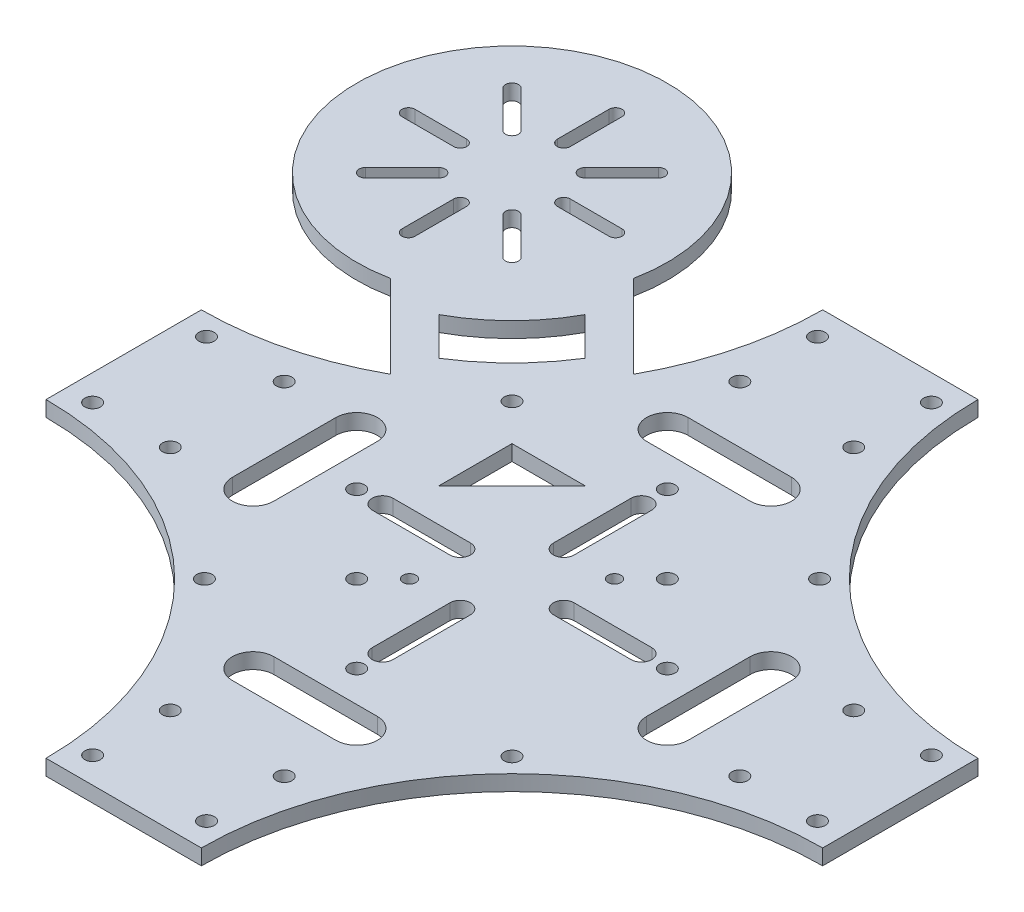
from build123d import *

# Parameters (mm, degrees)
SKETCH_1_R               = 1.25
EXTRUDE_1_DEPTH          = 3
SKETCH_2_R               = 1.5
CUT_EXTRUDE_1_DEPTH      = 3
CUT_EXTRUDE_2_DEPTH      = 3
CUT_EXTRUDE_3_DEPTH      = 3
CUT_EXTRUDE_4_DEPTH      = 10
SKETCH_6_R               = 1.5
CUT_EXTRUDE_5_DEPTH      = 10
SKETCH_7_R               = 1.5
CUT_EXTRUDE_8_DEPTH      = 10
SKETCH_8_R               = 1.5
CUT_EXTRUDE_9_DEPTH      = 10
SKETCH_9_R               = 15
CUT_EXTRUDE_10_DEPTH     = 10
SKETCH_11_R              = 1.5
EXTRUDE_3_DEPTH          = 3
CUT_EXTRUDE_12_DEPTH     = 3
EXTRUDE_4_DEPTH          = 3
SKETCH_15_R              = 15
EXTRUDE_5_DEPTH          = 3
CUT_EXTRUDE_13_DEPTH     = 3
EXTRUDE_START            = -3
EXTRUDE_7_DEPTH          = 3
CUT_EXTRUDE_14_DEPTH     = 3
CUT_EXTRUDE_15_DEPTH     = 3
PATTERN_CIRCULAR_1_COUNT = 8
SKETCH_22_R              = 1.25
CUT_EXTRUDE_17_DEPTH     = 3
SKETCH_23_R              = 1.5
CUT_EXTRUDE_18_DEPTH     = 10
SKETCH_24_R              = 1.5
CUT_EXTRUDE_19_DEPTH     = 10
CUT_EXTRUDE_20_DEPTH     = 10
SKETCH_26_R              = 1.5
CUT_EXTRUDE_21_DEPTH     = 66


with BuildPart() as part:
    # 草图1 → 凸台-拉伸1 (new body)
    # profile 1 of 4: a face of its own
    with BuildSketch(Plane(origin=(0, 0, 0), x_dir=(1, 0, 0), z_dir=(0, 1, 0))):
        with BuildLine():
            ThreePointArc((75, -15), (32.573593129, -32.573593129), (15, -75))
            Line((15, -75), (0, -75))
            Line((0, -75), (0, 0))
            Line((0, 0), (75, 0))
            Line((75, 0), (75, -15))
        make_face()
        with Locations(Location((11, -70, 0), (0, 0, 270))):
            Circle(SKETCH_1_R, mode=Mode.SUBTRACT)
        with Locations(Location((70, -11, 0), (0, 0, 270))):
            Circle(SKETCH_1_R, mode=Mode.SUBTRACT)
    # profile 2 of 4: a face of its own
    with BuildSketch(Plane(origin=(0, 0, 0), x_dir=(1, 0, 0), z_dir=(0, 1, 0))):
        with BuildLine():
            ThreePointArc((-15, -75), (-32.573593129, -32.573593129), (-75, -15))
            Line((-75, -15), (-75, 0))
            Line((-75, 0), (0, 0))
            Line((0, 0), (0, -75))
            Line((0, -75), (-15, -75))
        make_face()
        with Locations(Location((-70, -11, 0), (0, 0, 270))):
            Circle(SKETCH_1_R, mode=Mode.SUBTRACT)
        with Locations(Location((-11, -70, 0), (0, 0, 270))):
            Circle(SKETCH_1_R, mode=Mode.SUBTRACT)
    # profile 3 of 4: a face of its own
    with BuildSketch(Plane(origin=(0, 0, 0), x_dir=(1, 0, 0), z_dir=(0, 1, 0))):
        with BuildLine():
            ThreePointArc((-75, 15), (-32.573593129, 32.573593129), (-15, 75))
            Line((-15, 75), (0, 75))
            Line((0, 75), (0, 0))
            Line((0, 0), (-75, 0))
            Line((-75, 0), (-75, 15))
        make_face()
        with Locations(Location((-11, 70, 0), (0, 0, 270))):
            Circle(SKETCH_1_R, mode=Mode.SUBTRACT)
        with Locations(Location((-70, 11, 0), (0, 0, 270))):
            Circle(SKETCH_1_R, mode=Mode.SUBTRACT)
    # profile 4 of 4: a face of its own
    with BuildSketch(Plane(origin=(0, 0, 0), x_dir=(1, 0, 0), z_dir=(0, 1, 0))):
        with BuildLine():
            ThreePointArc((15, 75), (32.573593129, 32.573593129), (75, 15))
            Line((75, 15), (75, 0))
            Line((75, 0), (0, 0))
            Line((0, 0), (0, 75))
            Line((0, 75), (15, 75))
        make_face()
        with Locations(Location((70, 11, 0), (0, 0, 270))):
            Circle(SKETCH_1_R, mode=Mode.SUBTRACT)
        with Locations(Location((11, 70, 0), (0, 0, 270))):
            Circle(SKETCH_1_R, mode=Mode.SUBTRACT)
    extrude(amount=EXTRUDE_1_DEPTH)

    # 草图2 → 切除-拉伸1 (cut)
    with BuildSketch(Plane.XZ):
        with Locations(Location((0.353553391, -31.466251763, 0), (0, 0, 270))):
            Circle(SKETCH_2_R)
        with Locations(Location((31.466251763, -0.353553391, 0), (0, 0, 270))):
            Circle(SKETCH_2_R)
        with Locations(Location((-0.353553391, 31.466251763, 0), (0, 0, 90))):
            Circle(SKETCH_2_R)
        with Locations(Location((-31.466251763, 0.353553391, 0), (0, 0, 90))):
            Circle(SKETCH_2_R)
    extrude(amount=-CUT_EXTRUDE_1_DEPTH, mode=Mode.SUBTRACT)

    # 草图3 → 切除-拉伸2 (cut)
    with BuildSketch(Plane(origin=(0, 3, 0), x_dir=(1, 0, 0), z_dir=(0, 1, 0))):
        Polygon((-15.556349186, 15.556349186), (-12.02081528, 19.091883092), (-22.627416998, 22.627416998), align=None)
        Polygon((-19.091883092, 12.02081528), (-15.556349186, 15.556349186), (-22.627416998, 22.627416998), align=None)
    extrude(amount=-CUT_EXTRUDE_2_DEPTH, mode=Mode.SUBTRACT)

    # 草图4 → 切除-拉伸3 (cut)
    with BuildSketch(Plane(origin=(0, 3, 0), x_dir=(1, 0, 0), z_dir=(0, 1, 0))):
        with BuildLine():
            ThreePointArc((33.944668714, -19.80253309), (34.043922781, -8.582763971), (22.827665534, -8.285032838))
            Line((22.827665534, -8.285032838), (15.556349186, -15.556349186))
            Line((15.556349186, -15.556349186), (8.285032838, -22.827665534))
            ThreePointArc((8.285032838, -22.827665534), (8.582763971, -34.043922781), (19.80253309, -33.944668714))
            Line((19.80253309, -33.944668714), (33.944668714, -19.80253309))
        make_face()
    extrude(amount=-CUT_EXTRUDE_3_DEPTH, mode=Mode.SUBTRACT)

    # 草图5 → 切除-拉伸4 (cut)
    with BuildSketch(Plane(origin=(0, 3, 0), x_dir=(1, 0, 0), z_dir=(0, 1, 0))):
        Polygon((-22.627416998, 8.485281374), (-22.627416998, 22.627416998), (-19.091883092, 12.02081528), align=None)
        Polygon((-12.02081528, 19.091883092), (-22.627416998, 22.627416998), (-8.485281374, 22.627416998), align=None)
    extrude(amount=-CUT_EXTRUDE_4_DEPTH, mode=Mode.SUBTRACT)

    # 草图6 → 切除-拉伸5 (cut)
    with BuildSketch(Plane(origin=(0, 3, 0), x_dir=(1, 0, 0), z_dir=(0, 1, 0))):
        with Locations(Location((-35.355339059, -21.213203436, 0), (0, 0, 270))):
            Circle(SKETCH_6_R)
        with Locations(Location((-21.213203436, -35.355339059, 0), (0, 0, 270))):
            Circle(SKETCH_6_R)
        with Locations(Location((35.355339059, 21.213203436, 0), (0, 0, 270))):
            Circle(SKETCH_6_R)
        with Locations(Location((21.213203436, 35.355339059, 0), (0, 0, 270))):
            Circle(SKETCH_6_R)
    extrude(amount=-CUT_EXTRUDE_5_DEPTH, mode=Mode.SUBTRACT)

    # 草图7 → 切除-拉伸8 (cut)
    with BuildSketch(Plane(origin=(0, 3, 0), x_dir=(1, 0, 0), z_dir=(0, 1, 0))):
        with Locations(Location((-29.69848481, 29.69848481, 0), (0, 0, 270))):
            Circle(SKETCH_7_R)
        with Locations(Location((29.69848481, 29.69848481, 0), (0, 0, 270))):
            Circle(SKETCH_7_R)
        with Locations(Location((29.69848481, -29.69848481, 0), (0, 0, 270))):
            Circle(SKETCH_7_R)
        with Locations(Location((-29.69848481, -29.69848481, 0), (0, 0, 270))):
            Circle(SKETCH_7_R)
    extrude(amount=-CUT_EXTRUDE_8_DEPTH, mode=Mode.SUBTRACT)

    # 草图8 → 切除-拉伸9 (cut)
    with BuildSketch(Plane(origin=(0, 3, 0), x_dir=(1, 0, 0), z_dir=(0, 1, 0))):
        with Locations(Location((-11, 55, 0), (0, 0, 270))):
            Circle(SKETCH_8_R)
        with Locations(Location((11, 55, 0), (0, 0, 270))):
            Circle(SKETCH_8_R)
        with Locations(Location((55, 11, 0), (0, 0, 270))):
            Circle(SKETCH_8_R)
        with Locations(Location((55, -11, 0), (0, 0, 270))):
            Circle(SKETCH_8_R)
        with Locations(Location((11, -55, 0), (0, 0, 270))):
            Circle(SKETCH_8_R)
        with Locations(Location((-11, -55, 0), (0, 0, 270))):
            Circle(SKETCH_8_R)
        with Locations(Location((-55, -11, 0), (0, 0, 270))):
            Circle(SKETCH_8_R)
        with Locations(Location((-55, 11, 0), (0, 0, 270))):
            Circle(SKETCH_8_R)
    extrude(amount=-CUT_EXTRUDE_9_DEPTH, mode=Mode.SUBTRACT)

    # 草图9 → 切除-拉伸10 (cut)
    with BuildSketch(Plane(origin=(0, 3, 0), x_dir=(1, 0, 0), z_dir=(0, 1, 0))):
        with Locations(Location((0, 0, 0), (0, 0, 270))):
            Circle(SKETCH_9_R)
    extrude(amount=-CUT_EXTRUDE_10_DEPTH, mode=Mode.SUBTRACT)

    # 草图11 → 凸台-拉伸3 (add)
    with BuildSketch(Plane(origin=(0, 3, 0), x_dir=(1, 0, 0), z_dir=(0, 1, 0))):
        with Locations((-35.355339059, -21.213203436)):
            Circle(SKETCH_11_R)
        with Locations((35.355339059, 21.213203436)):
            Circle(SKETCH_11_R)
        with Locations((21.213203436, 35.355339059)):
            Circle(SKETCH_11_R)
        with Locations((0.353553391, 31.466251763)):
            Circle(SKETCH_11_R)
        with Locations((31.466251763, 0.353553391)):
            Circle(SKETCH_11_R)
        with Locations((-0.353553391, -31.466251763)):
            Circle(SKETCH_11_R)
        with Locations((-31.466251763, -0.353553391)):
            Circle(SKETCH_11_R)
        with Locations((-21.213203436, -35.355339059)):
            Circle(SKETCH_11_R)
    extrude(amount=-EXTRUDE_3_DEPTH)

    # 草图12 → 切除-拉伸12 (cut)
    with BuildSketch(Plane(origin=(0, 3, 0), x_dir=(1, 0, 0), z_dir=(0, 1, 0))):
        with BuildLine():
            Line((-44, -10), (-44, 10))
            ThreePointArc((-44, 10), (-40, 14), (-36, 10))
            Line((-36, 10), (-36, -10))
            ThreePointArc((-36, -10), (-40, -14), (-44, -10))
        make_face()
        with BuildLine():
            Line((-10, 44), (10, 44))
            ThreePointArc((10, 44), (14, 40), (10, 36))
            Line((10, 36), (-10, 36))
            ThreePointArc((-10, 36), (-14, 40), (-10, 44))
        make_face()
        with BuildLine():
            Line((44, 10), (44, -10))
            ThreePointArc((44, -10), (40, -14), (36, -10))
            Line((36, -10), (36, 10))
            ThreePointArc((36, 10), (40, 14), (44, 10))
        make_face()
        with BuildLine():
            Line((10, -44), (-10, -44))
            ThreePointArc((-10, -44), (-14, -40), (-10, -36))
            Line((-10, -36), (10, -36))
            ThreePointArc((10, -36), (14, -40), (10, -44))
        make_face()
    extrude(amount=-CUT_EXTRUDE_12_DEPTH, mode=Mode.SUBTRACT)

    # 草图14 → 凸台-拉伸4 (add)
    with BuildSketch(Plane(origin=(0, 3, 0), x_dir=(1, 0, 0), z_dir=(0, 1, 0))):
        with BuildLine():
            ThreePointArc((32.185650849, -7.152183109), (27.322232167, -6.195143755), (22.827665534, -8.285032838))
            Line((22.827665534, -8.285032838), (21.61516096, -18.569682002))
            ThreePointArc((21.61516096, -18.569682002), (27.487806659, -22.107425519), (33.944668714, -19.80253309))
            ThreePointArc((33.944668714, -19.80253309), (35.679936943, -17.205520658), (36.289282113, -14.142135624))
            ThreePointArc((36.289282113, -14.142135624), (35.187559777, -10.089382679), (32.185650849, -7.152183109))
        make_face()
        with BuildLine():
            Line((22.827665534, -8.285032838), (22.427168462, -8.685529911))
            ThreePointArc((22.427168462, -8.685529911), (20.306137435, -13.486712231), (21.61516096, -18.569682002))
            Line((21.61516096, -18.569682002), (22.827665534, -8.285032838))
        make_face()
        with BuildLine():
            Line((22.427168462, -8.685529911), (8.285032838, -22.827665534))
            ThreePointArc((8.285032838, -22.827665534), (8.582763971, -34.043922781), (19.80253309, -33.944668714))
            Line((19.80253309, -33.944668714), (21.61516096, -18.569682002))
            ThreePointArc((21.61516096, -18.569682002), (20.306137435, -13.486712231), (22.427168462, -8.685529911))
        make_face()
        with BuildLine():
            Line((21.61516096, -18.569682002), (19.80253309, -33.944668714))
            Line((19.80253309, -33.944668714), (33.944668714, -19.80253309))
            ThreePointArc((33.944668714, -19.80253309), (27.487806659, -22.107425519), (21.61516096, -18.569682002))
        make_face()
    extrude(amount=-EXTRUDE_4_DEPTH)

    # 草图15 → 凸台-拉伸5 (add)
    with BuildSketch(Plane(origin=(0, 3, 0), x_dir=(1, 0, 0), z_dir=(0, 1, 0))):
        Circle(SKETCH_15_R)
    extrude(amount=-EXTRUDE_5_DEPTH)

    # 草图17 → 切除-拉伸13 (cut)
    with BuildSketch(Plane(origin=(0, 3, 0), x_dir=(1, 0, 0), z_dir=(0, 1, 0))):
        with BuildLine():
            Line((-2, -20), (-2, -10))
            ThreePointArc((-2, -10), (0, -8), (2, -10))
            Line((2, -10), (2, -20))
            ThreePointArc((2, -20), (0, -22), (-2, -20))
        make_face()
        with BuildLine():
            Line((-20, 2), (-10, 2))
            ThreePointArc((-10, 2), (-8, 0), (-10, -2))
            Line((-10, -2), (-20, -2))
            ThreePointArc((-20, -2), (-22, 0), (-20, 2))
        make_face()
        with BuildLine():
            Line((2, 20), (2, 10))
            ThreePointArc((2, 10), (0, 8), (-2, 10))
            Line((-2, 10), (-2, 20))
            ThreePointArc((-2, 20), (0, 22), (2, 20))
        make_face()
        with BuildLine():
            Line((20, -2), (10, -2))
            ThreePointArc((10, -2), (8, 0), (10, 2))
            Line((10, 2), (20, 2))
            ThreePointArc((20, 2), (22, 0), (20, -2))
        make_face()
    extrude(amount=-CUT_EXTRUDE_13_DEPTH, mode=Mode.SUBTRACT)

    # 草图18 → 凸台-拉伸7 (add)
    with BuildSketch(Plane(origin=(0, 3, 0), x_dir=(1, 0, 0), z_dir=(0, 1, 0)).offset(EXTRUDE_START)):
        with BuildLine():
            Line((-61.977302058, 38.525223259), (-50.251262658, 50.251262658))
            Line((-50.251262658, 50.251262658), (-38.525223259, 61.977302058))
            ThreePointArc((-38.525223259, 61.977302058), (-38.078377186, 64.938218885), (-37.928932188, 67.928932188))
            ThreePointArc((-37.928932188, 67.928932188), (-91.15121571, 86.921708395), (-61.977302058, 38.525223259))
        make_face()
        with BuildLine():
            ThreePointArc((-61.977302058, 38.525223259), (-53.742560533, 41.49511182), (-46.715728753, 46.715728753))
            Line((-46.715728753, 46.715728753), (-50.251262658, 50.251262658))
            Line((-50.251262658, 50.251262658), (-61.977302058, 38.525223259))
        make_face()
        with BuildLine():
            Line((-50.251262658, 50.251262658), (-46.715728753, 46.715728753))
            ThreePointArc((-46.715728753, 46.715728753), (-41.49511182, 53.742560534), (-38.525223259, 61.977302058))
            Line((-38.525223259, 61.977302058), (-50.251262658, 50.251262658))
        make_face()
        with BuildLine():
            ThreePointArc((-45.952273324, 22.500194525), (-38.909748111, 27.067821679), (-32.573593129, 32.573593129))
            Line((-32.573593129, 32.573593129), (-46.715728753, 46.715728753))
            ThreePointArc((-46.715728753, 46.715728753), (-53.742560533, 41.49511182), (-61.977302058, 38.525223259))
            Line((-61.977302058, 38.525223259), (-45.952273324, 22.500194525))
        make_face()
        with BuildLine():
            Line((-46.715728753, 46.715728753), (-32.573593129, 32.573593129))
            ThreePointArc((-32.573593129, 32.573593129), (-27.067821679, 38.909748111), (-22.500194525, 45.952273324))
            Line((-22.500194525, 45.952273324), (-38.525223259, 61.977302058))
            ThreePointArc((-38.525223259, 61.977302058), (-41.49511182, 53.742560534), (-46.715728753, 46.715728753))
        make_face()
    extrude(amount=EXTRUDE_7_DEPTH)

    # 草图19 → 切除-拉伸14 (cut)
    with BuildSketch(Plane(origin=(0, 3, 0), x_dir=(1, 0, 0), z_dir=(0, 1, 0))):
        with BuildLine():
            ThreePointArc((-37.140781925, 51.282917549), (-39.866501787, 47.012431525), (-43.180194847, 43.180194847))
            Line((-43.180194847, 43.180194847), (-36.109127035, 36.109127035))
            ThreePointArc((-36.109127035, 36.109127035), (-32.750813989, 39.866501787), (-29.833680261, 43.975815885))
            Line((-29.833680261, 43.975815885), (-37.140781925, 51.282917549))
        make_face()
        with BuildLine():
            Line((-36.109127035, 36.109127035), (-43.180194847, 43.180194847))
            ThreePointArc((-43.180194847, 43.180194847), (-47.012431525, 39.866501787), (-51.282917549, 37.140781925))
            Line((-51.282917549, 37.140781925), (-43.975815885, 29.833680261))
            ThreePointArc((-43.975815885, 29.833680261), (-39.866501787, 32.750813989), (-36.109127035, 36.109127035))
        make_face()
    extrude(amount=-CUT_EXTRUDE_14_DEPTH, mode=Mode.SUBTRACT)

    # 草图21 → 切除-拉伸15 (cut)
    with BuildSketch(Plane(origin=(0, 3, 0), x_dir=(1, 0, 0), z_dir=(0, 1, 0))):
        with BuildLine():
            Line((-81.187184335, 82.954951288), (-74.116116524, 75.883883476))
            ThreePointArc((-74.116116524, 75.883883476), (-74.116116524, 74.116116524), (-75.883883476, 74.116116524))
            Line((-75.883883476, 74.116116524), (-82.954951288, 81.187184335))
            ThreePointArc((-82.954951288, 81.187184335), (-82.954951288, 82.954951288), (-81.187184335, 82.954951288))
        make_face()
        with BuildLine():
            Line((-59.9739809, 61.741747853), (-52.902913088, 54.670680041))
            ThreePointArc((-52.902913088, 54.670680041), (-52.902913088, 52.902913088), (-54.670680041, 52.902913088))
            Line((-54.670680041, 52.902913088), (-61.741747853, 59.9739809))
            ThreePointArc((-61.741747853, 59.9739809), (-61.741747853, 61.741747853), (-59.9739809, 61.741747853))
        make_face()
    cut_extrude_15 = extrude(amount=-CUT_EXTRUDE_15_DEPTH, mode=Mode.SUBTRACT)

    # 阵列(圆周)1: 切除-拉伸15 ×8 about axis
    pattern_circular_1_axis = Axis((-67.928932188, 0, -67.928932188), (0, 1, 0))
    for i in range(1, PATTERN_CIRCULAR_1_COUNT):
        add(cut_extrude_15.rotate(pattern_circular_1_axis, i * 360 / PATTERN_CIRCULAR_1_COUNT), mode=Mode.SUBTRACT)

    # 草图22 → 切除-拉伸17 (cut)
    with BuildSketch(Plane(origin=(0, 3, 0), x_dir=(1, 0, 0), z_dir=(0, 1, 0))):
        with Locations(Location((9.899494937, 9.899494937, 0), (0, 0, 270))):
            Circle(SKETCH_22_R)
        with Locations(Location((-9.899494937, -9.899494937, 0), (0, 0, 270))):
            Circle(SKETCH_22_R)
    extrude(amount=-CUT_EXTRUDE_17_DEPTH, mode=Mode.SUBTRACT)

    # 草图23 → 切除-拉伸18 (cut)
    with BuildSketch(Plane(origin=(0, 3, 0), x_dir=(1, 0, 0), z_dir=(0, 1, 0))):
        with Locations(Location((0, 30, 0), (0, 0, 270))):
            Circle(SKETCH_23_R)
        with Locations(Location((30, 0, 0), (0, 0, 270))):
            Circle(SKETCH_23_R)
        with Locations(Location((0, -30, 0), (0, 0, 270))):
            Circle(SKETCH_23_R)
        with Locations(Location((-30, 0, 0), (0, 0, 270))):
            Circle(SKETCH_23_R)
    extrude(amount=-CUT_EXTRUDE_18_DEPTH, mode=Mode.SUBTRACT)

    # 草图24 → 切除-拉伸19 (cut)
    with BuildSketch(Plane(origin=(0, 3, 0), x_dir=(1, 0, 0), z_dir=(0, 1, 0))):
        with Locations(Location((-15, -15, 0), (0, 0, 270))):
            Circle(SKETCH_24_R)
        with Locations(Location((15, 15, 0), (0, 0, 270))):
            Circle(SKETCH_24_R)
    extrude(amount=-CUT_EXTRUDE_19_DEPTH, mode=Mode.SUBTRACT)

    # 草图25 → 切除-拉伸20 (cut)
    with BuildSketch(Plane(origin=(0, 3, 0), x_dir=(1, 0, 0), z_dir=(0, 1, 0))):
        with BuildLine():
            Line((-2, 10), (-2, 25))
            ThreePointArc((-2, 25), (0, 27), (2, 25))
            Line((2, 25), (2, 10))
            ThreePointArc((2, 10), (0, 8), (-2, 10))
        make_face()
        with BuildLine():
            Line((10, 2), (25, 2))
            ThreePointArc((25, 2), (27, 0), (25, -2))
            Line((25, -2), (10, -2))
            ThreePointArc((10, -2), (8, 0), (10, 2))
        make_face()
        with BuildLine():
            Line((2, -10), (2, -25))
            ThreePointArc((2, -25), (0, -27), (-2, -25))
            Line((-2, -25), (-2, -10))
            ThreePointArc((-2, -10), (0, -8), (2, -10))
        make_face()
        with BuildLine():
            Line((-10, -2), (-25, -2))
            ThreePointArc((-25, -2), (-27, 0), (-25, 2))
            Line((-25, 2), (-10, 2))
            ThreePointArc((-10, 2), (-8, 0), (-10, -2))
        make_face()
    extrude(amount=-CUT_EXTRUDE_20_DEPTH, mode=Mode.SUBTRACT)

    # 草图26 → 切除-拉伸21 (cut)
    with BuildSketch(Plane(origin=(0, 3, 0), x_dir=(1, 0, 0), z_dir=(0, 1, 0))):
        with Locations(Location((11, 70, 0), (0, 0, 270))):
            Circle(SKETCH_26_R)
        with Locations(Location((-11, 70, 0), (0, 0, 270))):
            Circle(SKETCH_26_R)
        with Locations(Location((70, 11, 0), (0, 0, 270))):
            Circle(SKETCH_26_R)
        with Locations(Location((70, -11, 0), (0, 0, 270))):
            Circle(SKETCH_26_R)
        with Locations(Location((11, -70, 0), (0, 0, 270))):
            Circle(SKETCH_26_R)
        with Locations(Location((-11, -70, 0), (0, 0, 270))):
            Circle(SKETCH_26_R)
        with Locations(Location((-70, -11, 0), (0, 0, 270))):
            Circle(SKETCH_26_R)
        with Locations(Location((-70, 11, 0), (0, 0, 270))):
            Circle(SKETCH_26_R)
    extrude(amount=-CUT_EXTRUDE_21_DEPTH, mode=Mode.SUBTRACT)


solid = part.part
